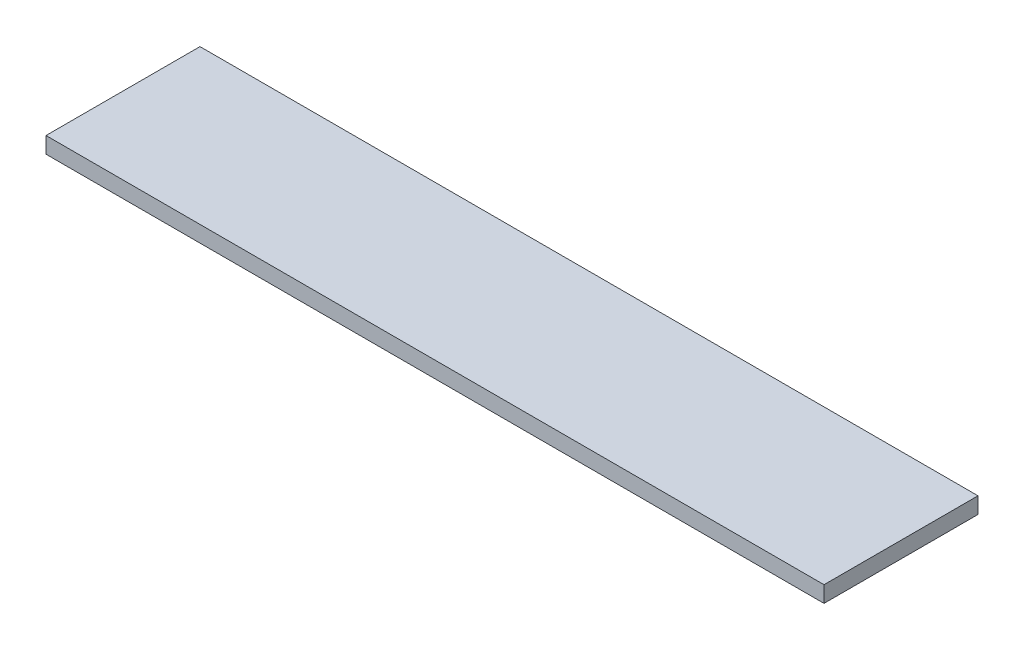
from build123d import *

# Parameters (mm, degrees)
SKETCH1_W           = 609.6
SKETCH1_H           = 120.65
BOSS_EXTRUDE1_DEPTH = 12.7


with BuildPart() as part:
    # Sketch1 → Boss-Extrude1 (new body)
    with BuildSketch(Plane(origin=(0, 0, 0), x_dir=(1, 0, 0), z_dir=(0, 1, 0))):
        with Locations((0, 60.325)):
            Rectangle(SKETCH1_W, SKETCH1_H)
    extrude(amount=BOSS_EXTRUDE1_DEPTH)


solid = part.part
